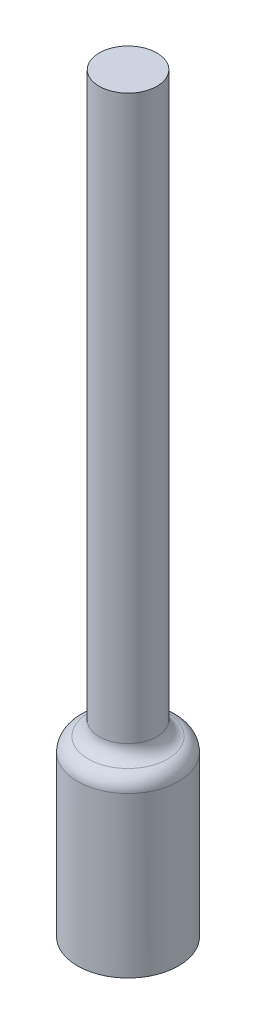
from build123d import *

# Parameters (mm, degrees)
SKETCH_1_R      = 3.5
SKETCH_1_R_2    = 1.99
EXTRUDE_1_DEPTH = 12
SKETCH_2_R      = 2
EXTRUDE_2_DEPTH = 40
FILLET_1_R      = 1
FILLET_2_R      = 1


with BuildPart() as part:
    # Эскиз1 → Вытянуть1 (new body)
    with BuildSketch(Plane(origin=(0, 0, 0), x_dir=(1, 0, 0), z_dir=(0, 1, 0))):
        with Locations(Location((0, 0, 0), (0, 0, 270))):
            Circle(SKETCH_1_R)
        with Locations(Location((0, 0, 0), (0, 0, 270))):
            Circle(SKETCH_1_R_2, mode=Mode.SUBTRACT)
    extrude(amount=EXTRUDE_1_DEPTH)

    # Эскиз2 → Вытянуть2 (add)
    with BuildSketch(Plane(origin=(0, 12, 0), x_dir=(1, 0, 0), z_dir=(0, 1, 0))):
        with Locations(Location((0, 0, 0), (0, 0, 270))):
            Circle(SKETCH_2_R)
    extrude(amount=EXTRUDE_2_DEPTH)

    # Скругление1
    fillet_1_edges = [part.edges().sort_by_distance(p)[0] for p in [
        (0, 12, -2),
    ]]
    fillet(fillet_1_edges, radius=FILLET_1_R)

    # Скругление2
    fillet_2_edges = [part.edges().sort_by_distance(p)[0] for p in [
        (0, 12, -3.5),
    ]]
    fillet(fillet_2_edges, radius=FILLET_2_R)


solid = part.part
